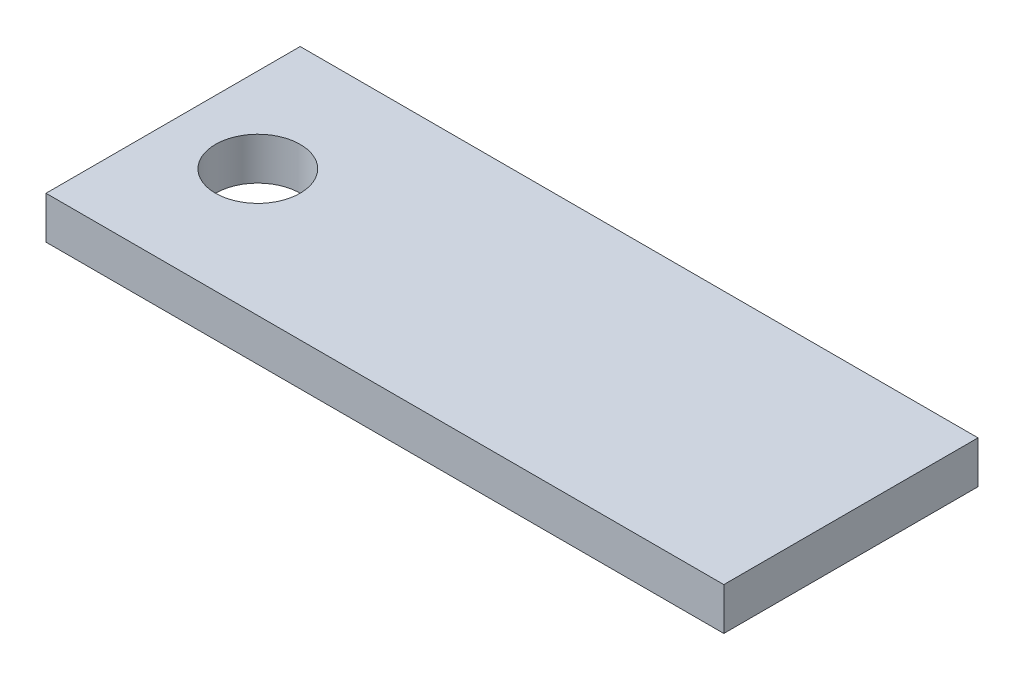
from build123d import *

# Parameters (mm, degrees)
SKETCH1_W           = 101.6
SKETCH1_H           = 38.1
BOSS_EXTRUDE1_DEPTH = 6.35
SKETCH2_R           = 6.35
CUT_EXTRUDE1_DEPTH  = 55.624765446


with BuildPart() as part:
    # Sketch1 → Boss-Extrude1 (new body)
    with BuildSketch(Plane(origin=(0, 0, 0), x_dir=(1, 0, 0), z_dir=(0, 1, 0))):
        Rectangle(SKETCH1_W, SKETCH1_H)
    extrude(amount=BOSS_EXTRUDE1_DEPTH)

    # Sketch2 → Cut-Extrude1 (cut, through all)
    with BuildSketch(Plane(origin=(0, 6.35, 0), x_dir=(1, 0, 0), z_dir=(0, 1, 0))):
        with Locations(Location((-38.1, 0, 0), (0, 0, 270))):
            Circle(SKETCH2_R)
    extrude(amount=-CUT_EXTRUDE1_DEPTH, mode=Mode.SUBTRACT)


solid = part.part
